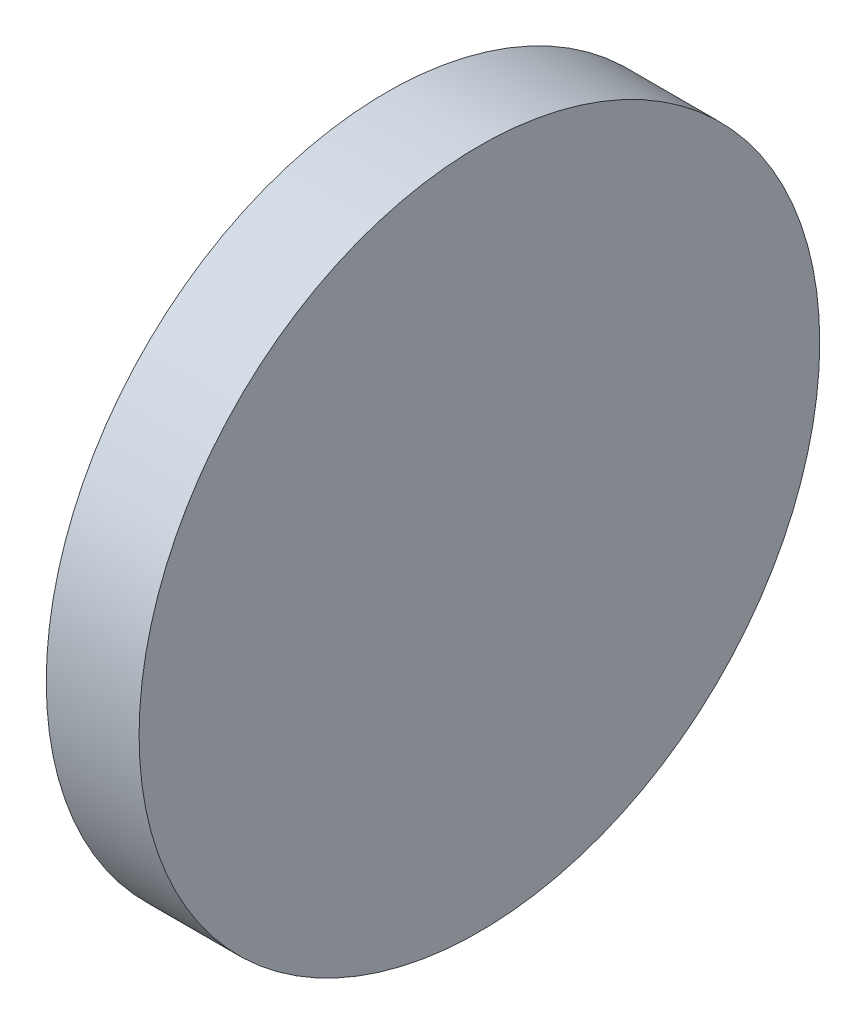
from build123d import *

# Parameters (mm, degrees)
SKETCH3_R           = 55
BOSS_EXTRUDE2_DEPTH = 15


with BuildPart() as part:
    # Sketch3 → Boss-Extrude2 (new body)
    with BuildSketch(Plane(origin=(0, 0, 0), x_dir=(0, 0, -1), z_dir=(1, 0, 0))):
        Circle(SKETCH3_R)
    extrude(amount=BOSS_EXTRUDE2_DEPTH)


solid = part.part
